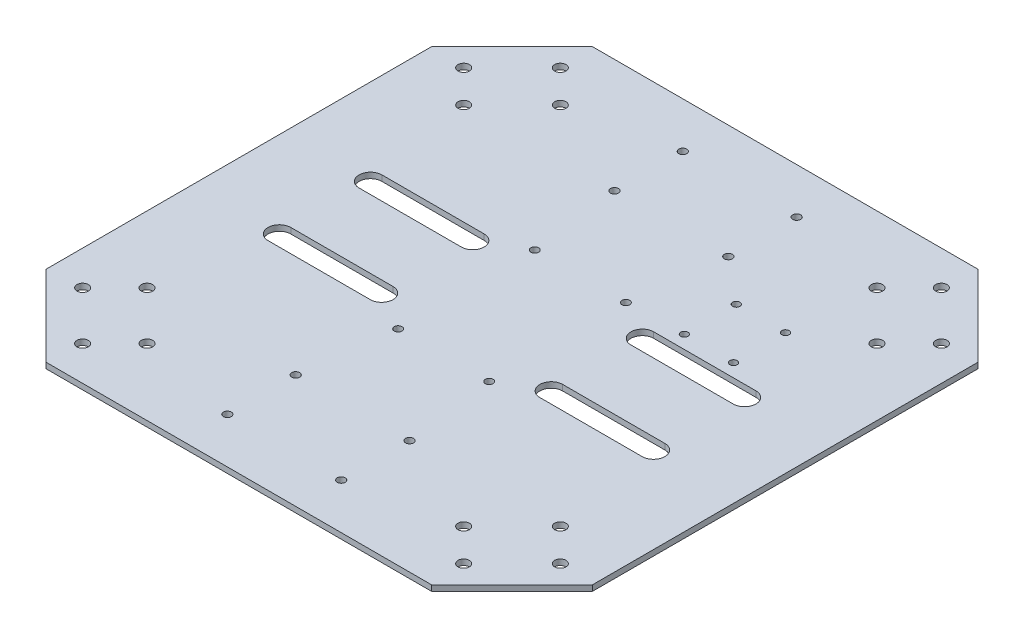
from build123d import *

# Parameters (mm, degrees)
BOSS_EXTRUDE1_DEPTH = 3.175
SKETCH2_R           = 3.175
CUT_EXTRUDE1_DEPTH  = 6.35
SKETCH3_R           = 2.159
CUT_EXTRUDE2_DEPTH  = 6.35
SKETCH4_R           = 2.2225
CUT_EXTRUDE3_DEPTH  = 351.937720963
SKETCH5_R           = 2.032
CUT_EXTRUDE5_DEPTH  = 351.937720963


with BuildPart() as part:
    # Sketch1 → Boss-Extrude1 (new body)
    with BuildSketch(Plane(origin=(0, 0, 0), x_dir=(1, 0, 0), z_dir=(0, 1, 0))):
        Polygon((-16.864769233, 51.656360067), (-61.766049839, 6.755079462), (-61.766049839, -208.242359328), (-16.864769233, -253.143639933), (198.132669556, -253.143639933), (243.033950161, -208.242359328), (243.033950161, 6.755079462), (198.132669556, 51.656360067), align=None)
        with BuildLine():
            ThreePointArc((43.337601054, -119.793639933), (49.687601054, -126.143639933), (43.337601054, -132.493639933))
            Line((43.337601054, -132.493639933), (-13.679235779, -132.493639933))
            ThreePointArc((-13.679235779, -132.493639933), (-20.029235779, -126.143639933), (-13.679235779, -119.793639933))
            Line((-13.679235779, -119.793639933), (43.337601054, -119.793639933))
        make_face(mode=Mode.SUBTRACT)
        with BuildLine():
            Line((194.947136102, -132.493639933), (137.930299269, -132.493639933))
            ThreePointArc((137.930299269, -132.493639933), (131.580299269, -126.143639933), (137.930299269, -119.793639933))
            Line((137.930299269, -119.793639933), (194.947136102, -119.793639933))
            ThreePointArc((194.947136102, -119.793639933), (201.297136102, -126.143639933), (194.947136102, -132.493639933))
        make_face(mode=Mode.SUBTRACT)
        with BuildLine():
            Line((-13.679235779, -68.993639933), (43.337601054, -68.993639933))
            ThreePointArc((43.337601054, -68.993639933), (49.687601054, -75.343639933), (43.337601054, -81.693639933))
            Line((43.337601054, -81.693639933), (-13.679235779, -81.693639933))
            ThreePointArc((-13.679235779, -81.693639933), (-20.029235779, -75.343639933), (-13.679235779, -68.993639933))
        make_face(mode=Mode.SUBTRACT)
        with BuildLine():
            ThreePointArc((137.930299269, -81.693639933), (131.580299269, -75.343639933), (137.930299269, -68.993639933))
            Line((137.930299269, -68.993639933), (194.947136102, -68.993639933))
            ThreePointArc((194.947136102, -68.993639933), (201.297136102, -75.343639933), (194.947136102, -81.693639933))
            Line((194.947136102, -81.693639933), (137.930299269, -81.693639933))
        make_face(mode=Mode.SUBTRACT)
    extrude(amount=BOSS_EXTRUDE1_DEPTH)

    # Sketch2 → Cut-Extrude1 (cut)
    with BuildSketch(Plane(origin=(0, 3.175, 0), x_dir=(1, 0, 0), z_dir=(0, 1, 0))):
        with Locations(Location((-15.627316695, 32.458395287, 0), (0, 0, 270))):
            Circle(SKETCH2_R)
        with Locations(Location((2.333195547, 14.497883045, 0), (0, 0, 270))):
            Circle(SKETCH2_R)
        with Locations(Location((-24.607572816, -12.442885319, 0), (0, 0, 270))):
            Circle(SKETCH2_R)
        with Locations(Location((-42.568085059, 5.517626924, 0), (0, 0, 270))):
            Circle(SKETCH2_R)
        with Locations(Location((205.875473139, -12.442885319, 0), (0, 0, 270))):
            Circle(SKETCH2_R)
        with Locations(Location((223.835985381, 5.517626924, 0), (0, 0, 270))):
            Circle(SKETCH2_R)
        with Locations(Location((178.934704776, 14.497883045, 0), (0, 0, 270))):
            Circle(SKETCH2_R)
        with Locations(Location((196.895217018, 32.458395287, 0), (0, 0, 270))):
            Circle(SKETCH2_R)
        with Locations(Location((-24.607572816, -189.044394548, 0), (0, 0, 270))):
            Circle(SKETCH2_R)
        with Locations(Location((-42.568085059, -207.00490679, 0), (0, 0, 270))):
            Circle(SKETCH2_R)
        with Locations(Location((-15.627316695, -233.945675153, 0), (0, 0, 270))):
            Circle(SKETCH2_R)
        with Locations(Location((2.333195547, -215.985162911, 0), (0, 0, 270))):
            Circle(SKETCH2_R)
        with Locations(Location((223.835985381, -207.00490679, 0), (0, 0, 270))):
            Circle(SKETCH2_R)
        with Locations(Location((196.895217018, -233.945675153, 0), (0, 0, 270))):
            Circle(SKETCH2_R)
        with Locations(Location((178.934704776, -215.985162911, 0), (0, 0, 270))):
            Circle(SKETCH2_R)
        with Locations(Location((205.875473139, -189.044394548, 0), (0, 0, 270))):
            Circle(SKETCH2_R)
    extrude(amount=-CUT_EXTRUDE1_DEPTH, mode=Mode.SUBTRACT)

    # Sketch3 → Cut-Extrude2 (cut)
    with BuildSketch(Plane(origin=(0, 3.175, 0), x_dir=(1, 0, 0), z_dir=(0, 1, 0))):
        with Locations(Location((65.233950161, -62.643639933, 0), (0, 0, 270))):
            Circle(SKETCH3_R)
        with Locations(Location((116.033950161, -62.643639933, 0), (0, 0, 270))):
            Circle(SKETCH3_R)
        with Locations(Location((65.233950161, -138.843639933, 0), (0, 0, 270))):
            Circle(SKETCH3_R)
        with Locations(Location((116.033950161, -138.843639933, 0), (0, 0, 270))):
            Circle(SKETCH3_R)
    extrude(amount=-CUT_EXTRUDE2_DEPTH, mode=Mode.SUBTRACT)

    # Sketch4 → Cut-Extrude3 (cut, through all)
    with BuildSketch(Plane(origin=(0, 3.175, 0), x_dir=(1, 0, 0), z_dir=(0, 1, 0))):
        with Locations(Location((58.883950161, 26.256360067, 0), (0, 0, 270))):
            Circle(SKETCH4_R)
        with Locations(Location((122.383950161, 26.256360067, 0), (0, 0, 270))):
            Circle(SKETCH4_R)
        with Locations(Location((58.883950161, -11.843639933, 0), (0, 0, 270))):
            Circle(SKETCH4_R)
        with Locations(Location((122.383950161, -11.843639933, 0), (0, 0, 270))):
            Circle(SKETCH4_R)
        with Locations(Location((122.383950161, -189.643639933, 0), (0, 0, 90))):
            Circle(SKETCH4_R)
        with Locations(Location((58.883950161, -189.643639933, 0), (0, 0, 90))):
            Circle(SKETCH4_R)
        with Locations(Location((122.383950161, -227.743639933, 0), (0, 0, 90))):
            Circle(SKETCH4_R)
        with Locations(Location((58.883950161, -227.743639933, 0), (0, 0, 90))):
            Circle(SKETCH4_R)
    extrude(amount=-CUT_EXTRUDE3_DEPTH, mode=Mode.SUBTRACT)

    # Sketch5 → Cut-Extrude5 (cut, through all)
    with BuildSketch(Plane(origin=(0, 0, 0), x_dir=(1, 0, 0), z_dir=(0, 1, 0))):
        with Locations(Location((147.669482851, -32.676069571, 0), (0, 0, 270))):
            Circle(SKETCH5_R)
        with Locations(Location((175.101482851, -32.676069571, 0), (0, 0, 270))):
            Circle(SKETCH5_R)
        with Locations(Location((175.101482851, -61.632069571, 0), (0, 0, 270))):
            Circle(SKETCH5_R)
        with Locations(Location((147.669482851, -61.632069571, 0), (0, 0, 270))):
            Circle(SKETCH5_R)
    extrude(amount=CUT_EXTRUDE5_DEPTH, mode=Mode.SUBTRACT)


solid = part.part
